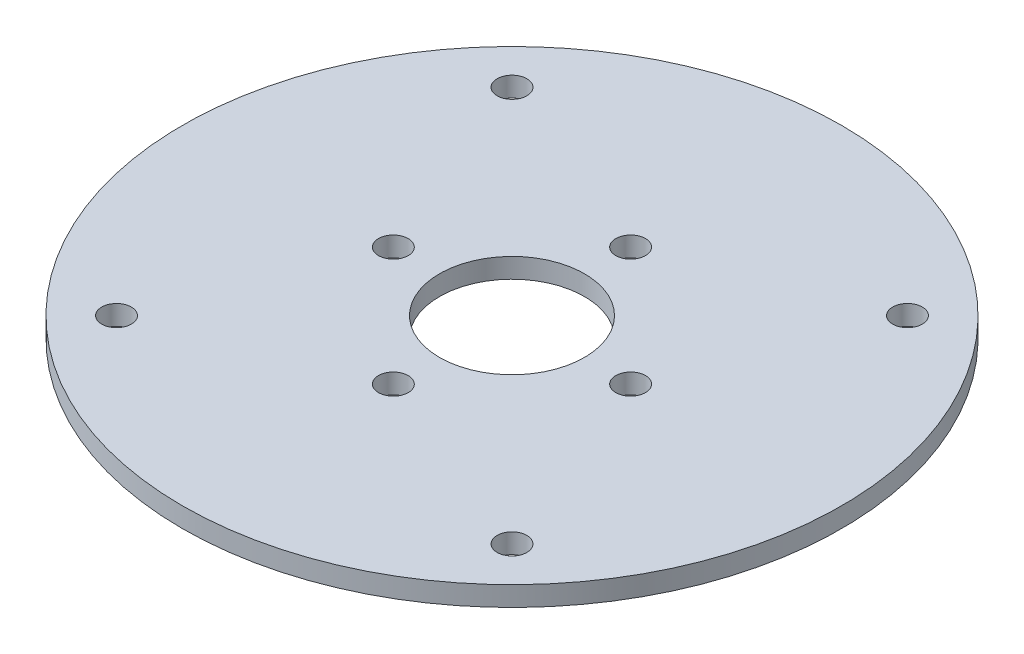
from build123d import *

# Parameters (mm, degrees)
SKETCH_1_R          = 50
EXTRUDE_2_DEPTH     = 3
SKETCH_3_R          = 2.25
CUT_EXTRUDE_1_DEPTH = 71.774289117
SKETCH_4_R          = 11
CUT_EXTRUDE_2_DEPTH = 71.774289117


with BuildPart() as part:
    # 草图1 → 凸台-拉伸2 (new body)
    with BuildSketch(Plane(origin=(0, 0, 0), x_dir=(1, 0, 0), z_dir=(0, 1, 0))):
        with Locations(Location((0, 0, 0), (0, 0, 270))):
            Circle(SKETCH_1_R)
    extrude(amount=EXTRUDE_2_DEPTH)

    # 草图3 → 切除-拉伸1 (cut, through all)
    with BuildSketch(Plane(origin=(0, 0, 0), x_dir=(1, 0, 0), z_dir=(0, 1, 0))):
        with Locations(Location((-18, 0, 0), (0, 0, 270))):
            Circle(SKETCH_3_R)
        with Locations(Location((-30, 30, 0), (0, 0, 270))):
            Circle(SKETCH_3_R)
        with Locations(Location((30, 30, 0), (0, 0, 270))):
            Circle(SKETCH_3_R)
        with Locations(Location((30, -30, 0), (0, 0, 270))):
            Circle(SKETCH_3_R)
        with Locations(Location((-30, -30, 0), (0, 0, 270))):
            Circle(SKETCH_3_R)
        with Locations(Location((0, 18, 0), (0, 0, 270))):
            Circle(SKETCH_3_R)
        with Locations(Location((18, 0, 0), (0, 0, 270))):
            Circle(SKETCH_3_R)
        with Locations(Location((0, -18, 0), (0, 0, 270))):
            Circle(SKETCH_3_R)
    extrude(amount=CUT_EXTRUDE_1_DEPTH, mode=Mode.SUBTRACT)

    # 草图4 → 切除-拉伸2 (cut, through all)
    with BuildSketch(Plane(origin=(0, 0, 0), x_dir=(1, 0, 0), z_dir=(0, 1, 0))):
        with Locations(Location((0, 0, 0), (0, 0, 270))):
            Circle(SKETCH_4_R)
    extrude(amount=CUT_EXTRUDE_2_DEPTH, mode=Mode.SUBTRACT)


solid = part.part
